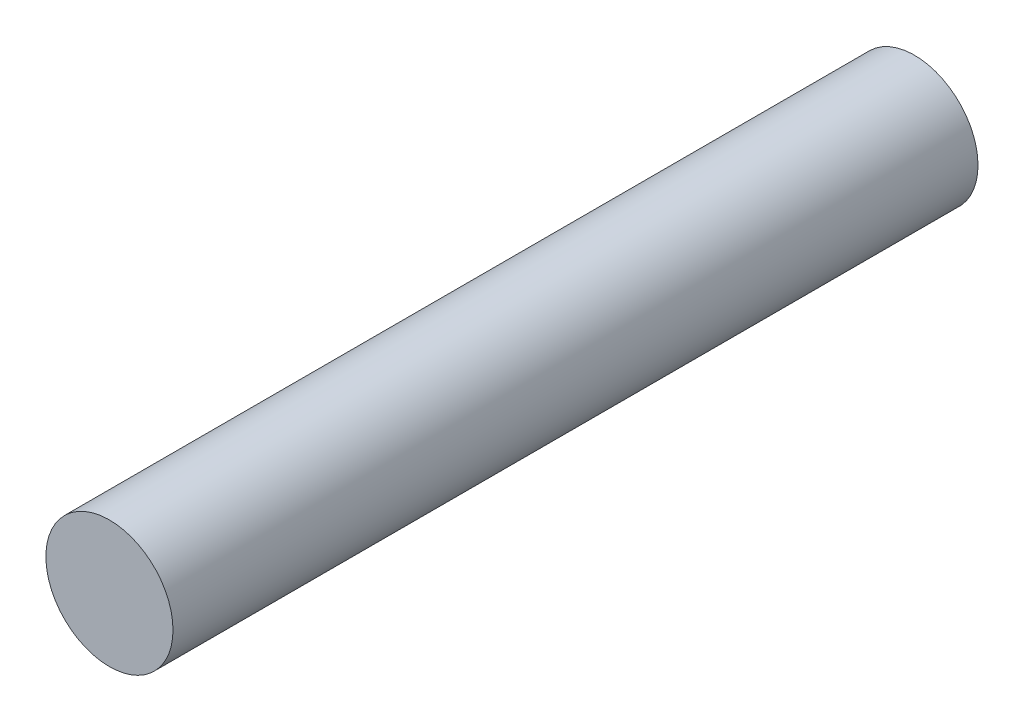
from build123d import *

# Parameters (mm, degrees)
CROQUIS1_R              = 6
SALIENTE_EXTRUIR1_DEPTH = 76


with BuildPart() as part:
    # Croquis1 → Saliente-Extruir1 (new body)
    with BuildSketch(Plane.XY):
        Circle(CROQUIS1_R)
    extrude(amount=SALIENTE_EXTRUIR1_DEPTH)


solid = part.part
